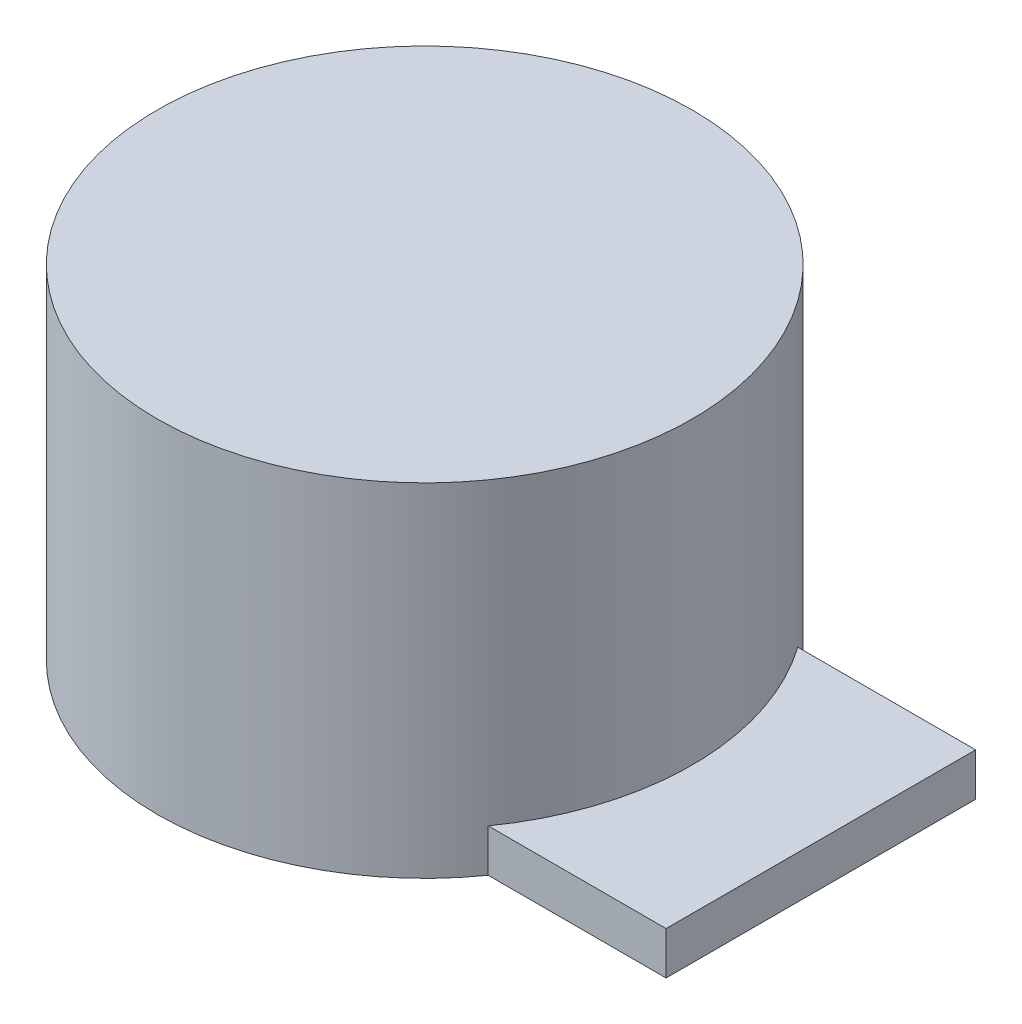
from build123d import *

# Parameters (mm, degrees)
SKETCH1_R           = 15.875
BOSS_EXTRUDE1_DEPTH = 20.32
SKETCH2_W           = 15.252884162
SKETCH2_H           = 18.365256134
BOSS_EXTRUDE2_DEPTH = 2.54


with BuildPart() as part:
    # Sketch1 → Boss-Extrude1 (new body)
    with BuildSketch(Plane(origin=(0, 0, 0), x_dir=(1, 0, 0), z_dir=(0, 1, 0))):
        with Locations(Location((0, 0, 0), (0, 0, 270))):
            Circle(SKETCH1_R)
    extrude(amount=BOSS_EXTRUDE1_DEPTH)

    # Sketch2 → Boss-Extrude2 (add)
    with BuildSketch(Plane.XZ):
        with Locations((15.875, 0)):
            Rectangle(SKETCH2_W, SKETCH2_H)
    extrude(amount=-BOSS_EXTRUDE2_DEPTH)


solid = part.part
